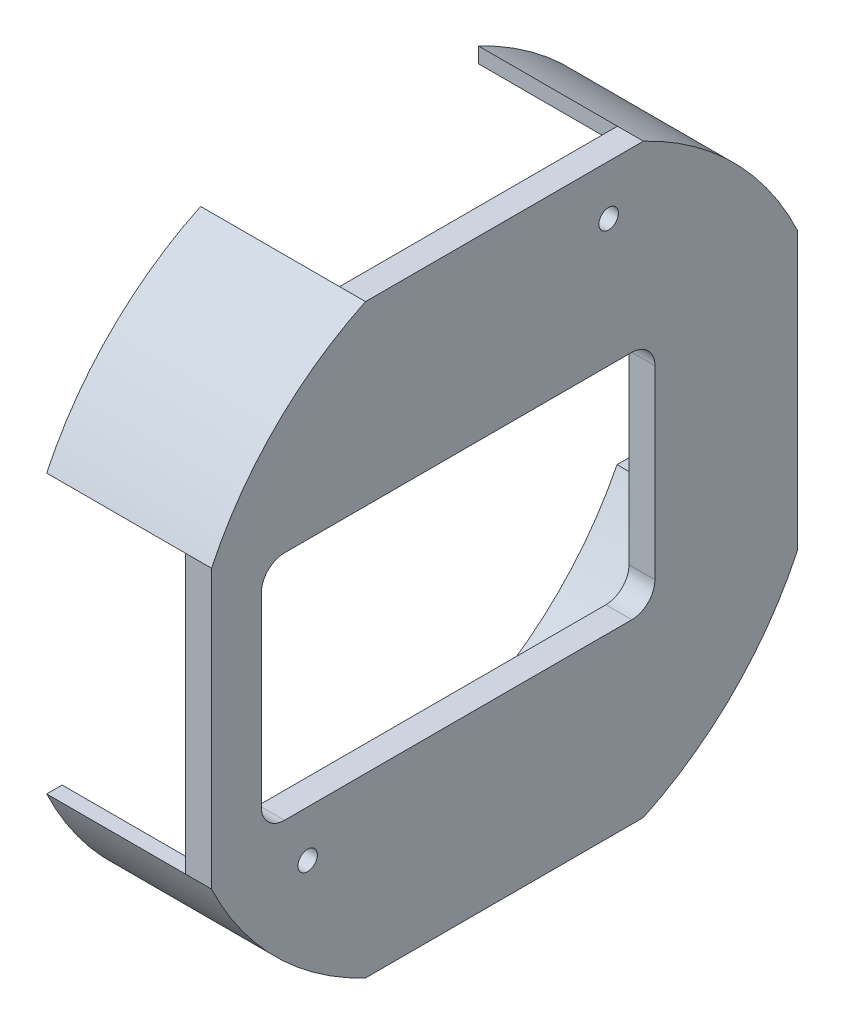
from build123d import *
from build123d.topology import SkipClean

# Parameters (mm, degrees)
SKETCH_1_R          = 70
SKETCH_1_R_2        = 2.1
SKETCH_1_W          = 85
SKETCH_1_H          = 50
EXTRUDE_2_DEPTH     = 5.6
FILLET_1_R          = 5
EXTRUDE_START       = 30
EXTRUDE_3_DEPTH     = 30
CUT_EXTRUDE_1_DEPTH = 111.453610172


with BuildPart() as part:
    # ｽｹｯﾁ1 → ﾎﾞｽ - 押し出し2 (new body)
    with BuildSketch(Plane(origin=(0, 0, 0), x_dir=(0, 0, -1), z_dir=(1, 0, 0))):
        with Locations((10, 0)):
            Circle(SKETCH_1_R)
        with Locations(Location((32.5, 52.5, 0), (0, 0, 180))):
            Circle(SKETCH_1_R_2, mode=Mode.SUBTRACT)
        with Locations((-32.5, -35)):
            Circle(SKETCH_1_R_2, mode=Mode.SUBTRACT)
        Rectangle(SKETCH_1_W, SKETCH_1_H, mode=Mode.SUBTRACT)
    extrude(amount=EXTRUDE_2_DEPTH)

    # ﾌｨﾚｯﾄ1
    fillet_1_edges = [part.edges().sort_by_distance(p)[0] for p in [
        (2.8, -25, -42.5),
        (2.8, 25, -42.5),
        (2.8, 25, 42.5),
        (2.8, -25, 42.5),
    ]]
    fillet(fillet_1_edges, radius=FILLET_1_R)

    # ｽｹｯﾁ2 → ﾎﾞｽ - 押し出し3 (add)
    with SkipClean():  # the faces are left unmerged after this step: merging them gives an invalid solid
        with BuildSketch(Plane.ZY.offset(EXTRUDE_START)):
            with BuildLine():
                ThreePointArc((-40, 63.245553203), (-59.497474683, 49.497474683), (-73.245553203, 30))
                Line((-73.245553203, 30), (-69.908263203, 30))
                ThreePointArc((-69.908263203, 30), (-57.376154339, 47.376154339), (-40, 59.908263203))
                Line((-40, 59.908263203), (-40, 63.245553203))
            make_face()
            with BuildLine():
                ThreePointArc((53.245553203, 30), (39.497474683, 49.497474683), (20, 63.245553203))
                Line((20, 63.245553203), (20, 59.908263203))
                ThreePointArc((20, 59.908263203), (37.376154339, 47.37615434), (49.908263203, 30))
                Line((49.908263203, 30), (53.245553203, 30))
            make_face()
            with BuildLine():
                Line((-69.908263203, -30), (-73.245553203, -30))
                ThreePointArc((-73.245553203, -30), (-59.497474683, -49.497474683), (-40, -63.245553203))
                Line((-40, -63.245553203), (-40, -59.908263203))
                ThreePointArc((-40, -59.908263203), (-57.376154339, -47.376154339), (-69.908263203, -30))
            make_face()
            with BuildLine():
                Line((20, -59.908263203), (20, -63.245553203))
                ThreePointArc((20, -63.245553203), (39.497474683, -49.497474683), (53.245553203, -30))
                Line((53.245553203, -30), (49.908263203, -30))
                ThreePointArc((49.908263203, -30), (37.376154339, -47.37615434), (20, -59.908263203))
            make_face()
        extrude(amount=-EXTRUDE_3_DEPTH)

    # ｽｹｯﾁ3 → ｶｯﾄ - 押し出し1 (cut, through all)
    with BuildSketch(Plane.ZY):
        with BuildLine():
            Line((20, 63.245553203), (-40, 63.245553203))
            ThreePointArc((-40, 63.245553203), (-10, 70), (20, 63.245553203))
        make_face()
        with BuildLine():
            Line((-73.245553203, 30), (-73.245553203, -30))
            ThreePointArc((-73.245553203, -30), (-80, 0), (-73.245553203, 30))
        make_face()
        with BuildLine():
            Line((-40, -63.245553203), (20, -63.245553203))
            ThreePointArc((20, -63.245553203), (-10, -70), (-40, -63.245553203))
        make_face()
        with BuildLine():
            Line((53.245553203, -30), (53.245553203, 30))
            ThreePointArc((53.245553203, 30), (60, 0), (53.245553203, -30))
        make_face()
    extrude(amount=-CUT_EXTRUDE_1_DEPTH, mode=Mode.SUBTRACT)


solid = part.part
